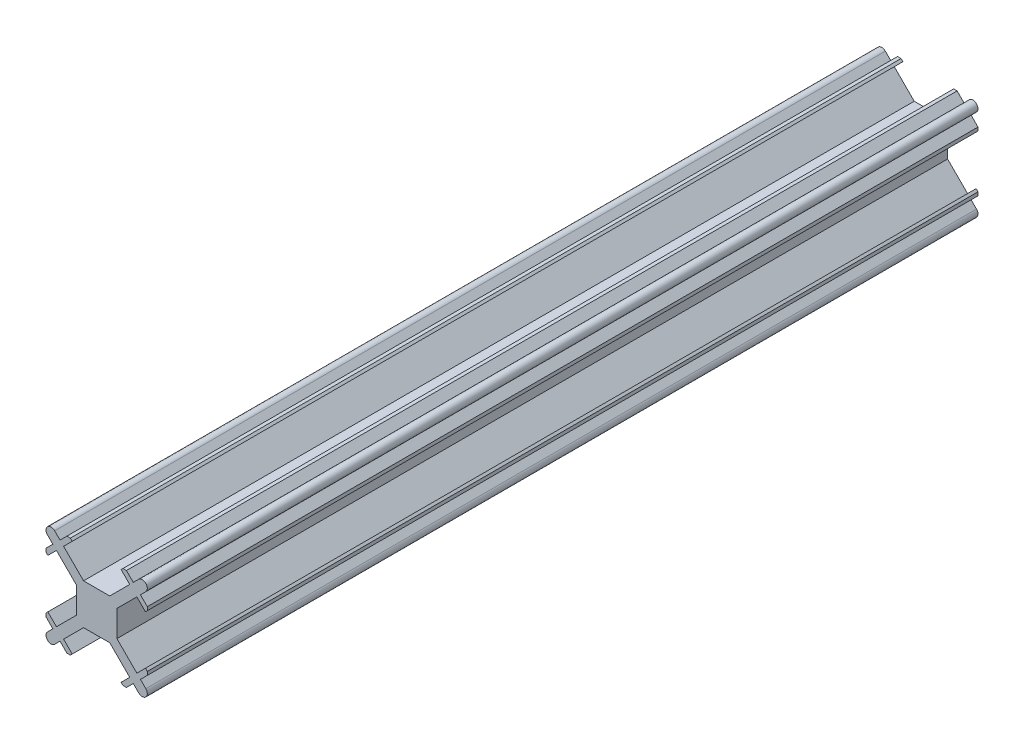
from build123d import *

# Parameters (mm, degrees)
BOSS_EXTRUDE1_DEPTH = 41


with BuildPart() as part:
    # Sketch2 → Boss-Extrude1 (new, symmetric)
    with BuildSketch(Plane.XY):
        with BuildLine():
            Line((-4.853553391, 4.146446609), (-4.323223305, 3.616116524))
            Line((-4.323223305, 3.616116524), (-5, 2.939339828))
            Line((-5, 2.939339828), (-5, 2.595836944))
            Line((-5, 2.595836944), (-4.818198052, 2.414034995))
            Line((-4.818198052, 2.414034995), (-3.969669914, 3.262563133))
            Line((-3.969669914, 3.262563133), (-2, 1.292893219))
            Line((-2, 1.292893219), (-2, -1.292893219))
            Line((-2, -1.292893219), (-3.969669914, -3.262563133))
            Line((-3.969669914, -3.262563133), (-4.818198052, -2.414034995))
            Line((-4.818198052, -2.414034995), (-5, -2.595836944))
            Line((-5, -2.595836944), (-5, -2.939339828))
            Line((-5, -2.939339828), (-4.323223305, -3.616116524))
            Line((-4.323223305, -3.616116524), (-4.853553391, -4.146446609))
            ThreePointArc((-4.853553391, -4.146446609), (-4.853553391, -4.853553391), (-4.146446609, -4.853553391))
            Line((-4.146446609, -4.853553391), (-3.616116524, -4.323223305))
            Line((-3.616116524, -4.323223305), (-2.939339828, -5))
            Line((-2.939339828, -5), (-2.595836944, -5))
            Line((-2.595836944, -5), (-2.414034995, -4.818198052))
            Line((-2.414034995, -4.818198052), (-3.262563133, -3.969669914))
            Line((-3.262563133, -3.969669914), (-1.292893219, -2))
            Line((-1.292893219, -2), (1.292893219, -2))
            Line((1.292893219, -2), (3.262563133, -3.969669914))
            Line((3.262563133, -3.969669914), (2.414034995, -4.818198052))
            Line((2.414034995, -4.818198052), (2.595836944, -5))
            Line((2.595836944, -5), (2.939339828, -5))
            Line((2.939339828, -5), (3.616116524, -4.323223305))
            Line((3.616116524, -4.323223305), (4.146446609, -4.853553391))
            ThreePointArc((4.146446609, -4.853553391), (4.853553391, -4.853553391), (4.853553391, -4.146446609))
            Line((4.853553391, -4.146446609), (4.323223305, -3.616116524))
            Line((4.323223305, -3.616116524), (5, -2.939339828))
            Line((5, -2.939339828), (5, -2.595836944))
            Line((5, -2.595836944), (4.818198052, -2.414034995))
            Line((4.818198052, -2.414034995), (3.969669914, -3.262563133))
            Line((3.969669914, -3.262563133), (2, -1.292893219))
            Line((2, -1.292893219), (2, 1.292893219))
            Line((2, 1.292893219), (3.969669914, 3.262563133))
            Line((3.969669914, 3.262563133), (4.818198052, 2.414034995))
            Line((4.818198052, 2.414034995), (5, 2.595836944))
            Line((5, 2.595836944), (5, 2.939339828))
            Line((5, 2.939339828), (4.323223305, 3.616116524))
            Line((4.323223305, 3.616116524), (4.853553391, 4.146446609))
            ThreePointArc((4.853553391, 4.146446609), (4.853553391, 4.853553391), (4.146446609, 4.853553391))
            Line((4.146446609, 4.853553391), (3.616116524, 4.323223305))
            Line((3.616116524, 4.323223305), (2.939339828, 5))
            Line((2.939339828, 5), (2.595836944, 5))
            Line((2.595836944, 5), (2.414034995, 4.818198052))
            Line((2.414034995, 4.818198052), (3.262563133, 3.969669914))
            Line((3.262563133, 3.969669914), (1.292893219, 2))
            Line((1.292893219, 2), (-1.292893219, 2))
            Line((-1.292893219, 2), (-3.262563133, 3.969669914))
            Line((-3.262563133, 3.969669914), (-2.414034995, 4.818198052))
            Line((-2.414034995, 4.818198052), (-2.595836944, 5))
            Line((-2.595836944, 5), (-2.939339828, 5))
            Line((-2.939339828, 5), (-3.616116524, 4.323223305))
            Line((-3.616116524, 4.323223305), (-4.146446609, 4.853553391))
            ThreePointArc((-4.146446609, 4.853553391), (-4.853553391, 4.853553391), (-4.853553391, 4.146446609))
        make_face()
    extrude(amount=BOSS_EXTRUDE1_DEPTH, both=True)


solid = part.part
